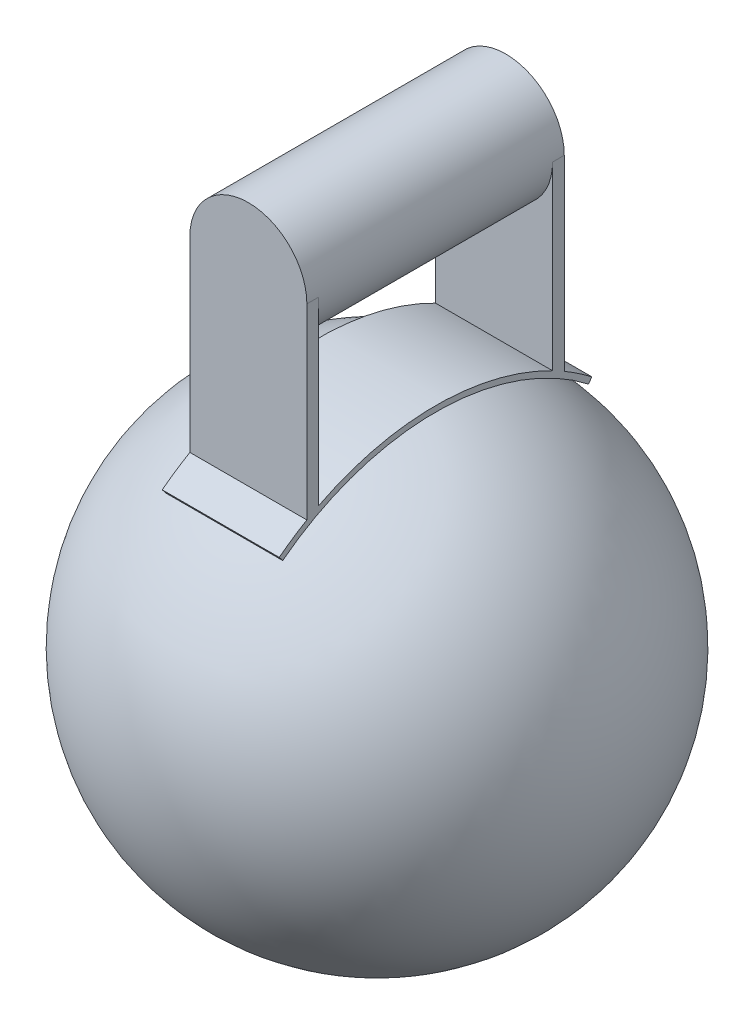
from build123d import *

# Parameters (mm, degrees)
SKETCH1_R           = 5
BOSS_EXTRUDE1_DEPTH = 20
BOSS_EXTRUDE2_DEPTH = 1
BOSS_EXTRUDE3_DEPTH = 10


with BuildPart() as part:
    # Sketch1 → Boss-Extrude1 (new body)
    with BuildSketch(Plane(origin=(665.830977627, 953.986238003, 1351.728059483), x_dir=(0.9995091318087403, 0.031328827474677086, -2.5067462927792515e-15), z_dir=(0, 0, 1))):
        with Locations(Location((-108.743838074, -120.183417572, 0), (0, 0, 268.204696647))):
            Circle(SKETCH1_R)
    extrude(amount=BOSS_EXTRUDE1_DEPTH)

    # Sketch2 → Boss-Extrude2 (add)
    with BuildSketch(Plane.XY.offset(1371.728059483)):
        with BuildLine():
            ThreePointArc((565.905723999, 830.454997706), (560.905723999, 835.454997707), (555.905723998, 830.454997706))
            Line((555.905723999, 830.454997706), (565.905723999, 830.454997706))
        make_face()
        with BuildLine():
            Line((565.905723999, 830.454997706), (555.905723999, 830.454997706))
            ThreePointArc((555.905723998, 830.454997706), (560.905723999, 825.454997706), (565.905723999, 830.454997706))
        make_face()
        with BuildLine():
            ThreePointArc((565.905723999, 830.454997706), (560.905723999, 825.454997706), (555.905723998, 830.454997706))
            Line((555.905723999, 830.454997706), (555.905723999, 814.462567416))
            Line((555.905723999, 814.462567416), (565.905723999, 814.462567416))
            Line((565.905723999, 814.462567416), (565.905723999, 830.454997706))
        make_face()
    boss_extrude2 = extrude(amount=BOSS_EXTRUDE2_DEPTH)

    # Mirror1: Boss-Extrude2 across plane
    add(boss_extrude2.mirror(Plane(origin=(665.830977627, 953.986238003, 1361.728059483), x_dir=(1, 0, 0), z_dir=(0, 0, 1))))

    # Sketch3 → Boss-Extrude3 (add)
    with BuildSketch(Plane.ZY.offset(-555.905723999)):
        with BuildLine():
            Line((1348.3673427, 812.875739584), (1348.663662071, 812.491448802))
            ThreePointArc((1348.663662071, 812.491448802), (1361.728059483, 816.943403278), (1374.792456895, 812.491448802))
            Line((1374.792456895, 812.491448802), (1375.088776266, 812.875739584))
            ThreePointArc((1375.088776266, 812.875739584), (1361.728059483, 817.428670807), (1348.3673427, 812.875739584))
        make_face()
    extrude(amount=-BOSS_EXTRUDE3_DEPTH)


with BuildPart() as body_2:
    # Sketch4 → Revolve1 (revolve)
    with BuildSketch(Plane(origin=(406.564991702, 879.934433154, 1361.728059483), x_dir=(1, 0, 0), z_dir=(0, 0, 1))):
        with BuildLine():
            Line((154.340732297, -62.884558376), (154.340732298, -102.884558376))
            ThreePointArc((154.340732298, -102.884558376), (174.340732298, -82.884558375), (154.340732297, -62.884558376))
        make_face()
    revolve(axis=Axis((560.905723999, 817.049874778, 1361.728059483), (3.471667398002861e-11, -1.0, 0)))


solid = Compound([part.part, body_2.part])
